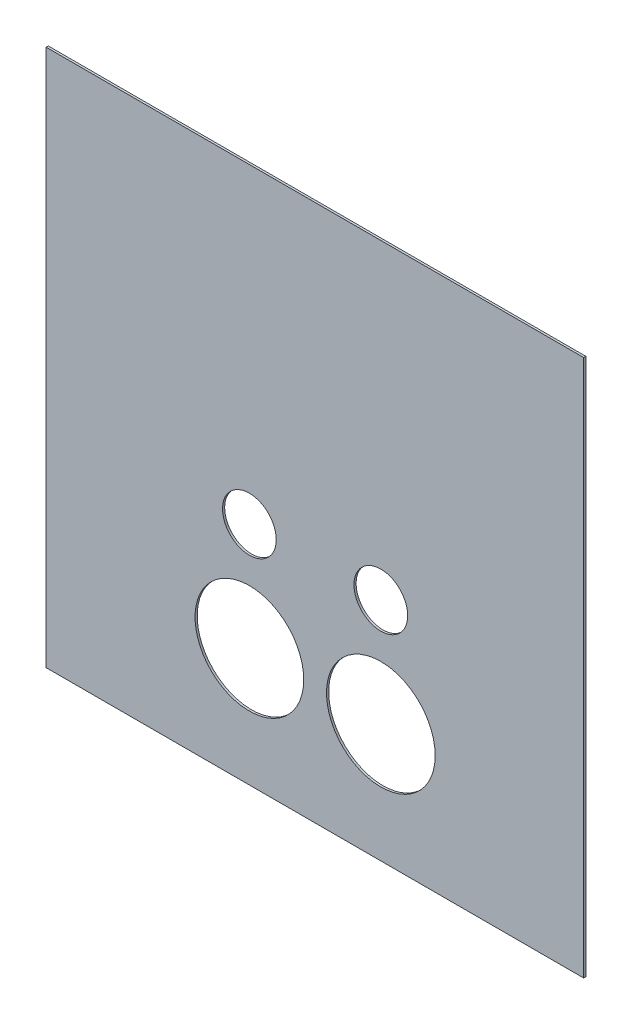
from build123d import *

# Parameters (mm, degrees)
SKETCH2_W           = 500
SKETCH2_H           = 500
BOSS_EXTRUDE2_DEPTH = 2
SKETCH5_R           = 50.55
CUT_EXTRUDE1_DEPTH  = 2
SKETCH6_R           = 25
CUT_EXTRUDE2_DEPTH  = 10


with BuildPart() as part:
    # Sketch2 → Boss-Extrude2 (new body)
    with BuildSketch(Plane.XY):
        with Locations((119.822485207, 79.881656805)):
            Rectangle(SKETCH2_W, SKETCH2_H)
    extrude(amount=BOSS_EXTRUDE2_DEPTH)

    # Sketch5 → Cut-Extrude1 (cut)
    with BuildSketch(Plane.XY.offset(2)):
        with Locations((58.842485207, -59.968343195)):
            Circle(SKETCH5_R)
        with Locations((181.142485207, -59.968343195)):
            Circle(SKETCH5_R)
    extrude(amount=-CUT_EXTRUDE1_DEPTH, mode=Mode.SUBTRACT)

    # Sketch6 → Cut-Extrude2 (cut)
    with BuildSketch(Plane.XY.offset(2)):
        with Locations((181.142485207, 40.031656805)):
            Circle(SKETCH6_R)
        with Locations((58.842485207, 40.031656805)):
            Circle(SKETCH6_R)
    extrude(amount=-CUT_EXTRUDE2_DEPTH, mode=Mode.SUBTRACT)


solid = part.part
